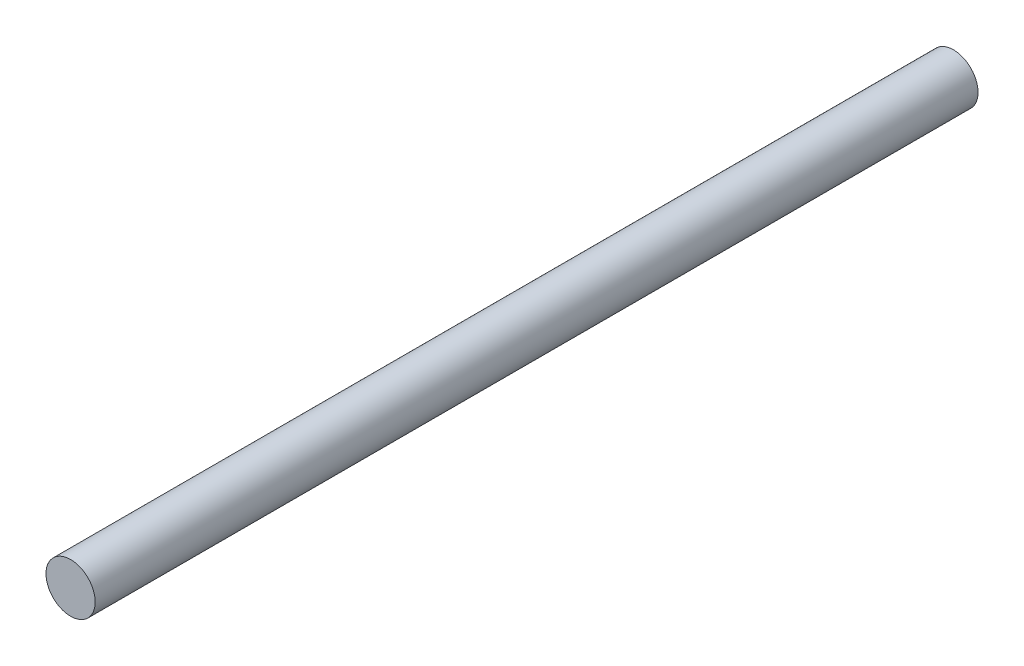
from build123d import *

# Parameters (mm, degrees)
SKETCH1_W = 3.9
SKETCH1_H = 140


with BuildPart() as part:
    # Sketch1 → Revolve1 (revolve)
    with BuildSketch(Plane.XZ, mode=Mode.PRIVATE) as revolve1_sk:
        with Locations((1.95, 110)):
            Rectangle(SKETCH1_W, SKETCH1_H)
    revolve(revolve1_sk.sketch.rotate(Axis((0, 0, 180), (0, 0, -1)), 180), axis=Axis((0, 0, 180), (0, 0, -1)))


solid = part.part
